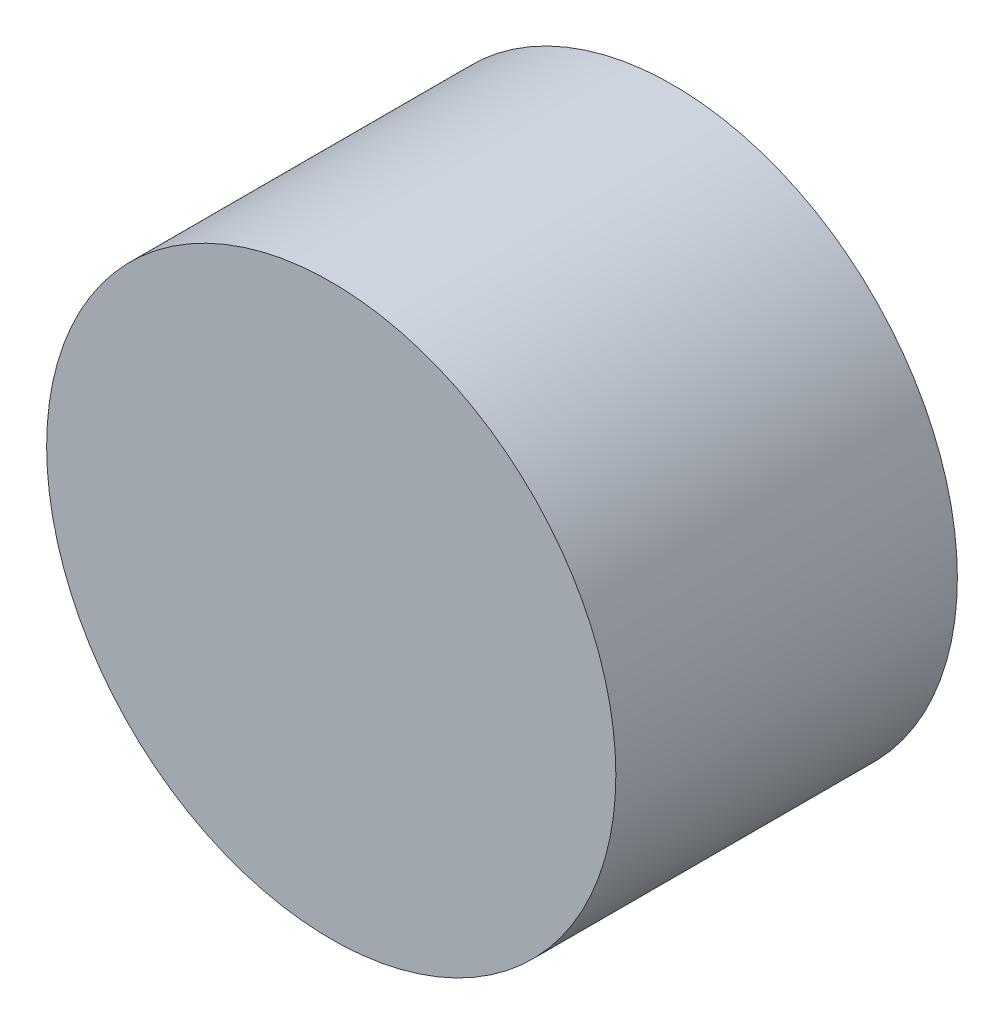
from build123d import *

# Parameters (mm, degrees)
SKETCH1_R           = 25
BOSS_EXTRUDE1_DEPTH = 30


with BuildPart() as part:
    # Sketch1 → Boss-Extrude1 (new body)
    with BuildSketch(Plane.XY):
        Circle(SKETCH1_R)
    extrude(amount=BOSS_EXTRUDE1_DEPTH)


solid = part.part
